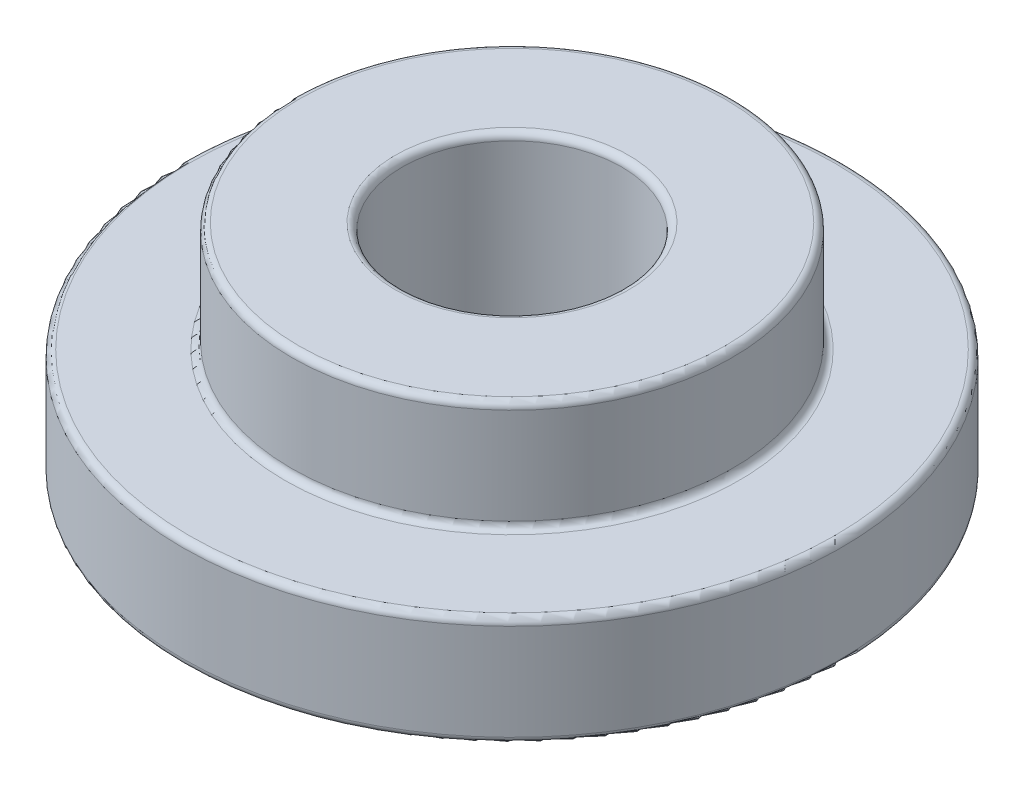
from build123d import *

# Parameters (mm, degrees)
SKETCH3_R           = 4.01
SKETCH3_R_2         = 2
BOSS_EXTRUDE1_DEPTH = 4
SKETCH4_R           = 6
SKETCH4_R_2         = 4.01
BOSS_EXTRUDE2_DEPTH = 2
FILLET1_R           = 0.125


with BuildPart() as part:
    # Sketch3 → Boss-Extrude1 (new body)
    with BuildSketch(Plane(origin=(0, 0, 0), x_dir=(1, 0, 0), z_dir=(0, 1, 0))):
        with Locations(Location((0, 0, 0), (0, 0, 270))):
            Circle(SKETCH3_R)
        with Locations(Location((0, 0, 0), (0, 0, 270))):
            Circle(SKETCH3_R_2, mode=Mode.SUBTRACT)
    extrude(amount=BOSS_EXTRUDE1_DEPTH)

    # Sketch4 → Boss-Extrude2 (add)
    with BuildSketch(Plane(origin=(0, 0, 0), x_dir=(1, 0, 0), z_dir=(0, 1, 0))):
        with Locations(Location((0, 0, 0), (0, 0, 270))):
            Circle(SKETCH4_R)
        with Locations(Location((0, 0, 0), (0, 0, 270))):
            Circle(SKETCH4_R_2, mode=Mode.SUBTRACT)
    extrude(amount=BOSS_EXTRUDE2_DEPTH)

    # Fillet1
    fillet1_edges = [part.edges().sort_by_distance(p)[0] for p in [
        (0, 0, -6),
        (0, 2, -4.01),
        (0, 4, -4.01),
        (0, 0, -2),
        (0, 4, -2),
        (0, 2, -6),
    ]]
    fillet(fillet1_edges, radius=FILLET1_R)


solid = part.part
